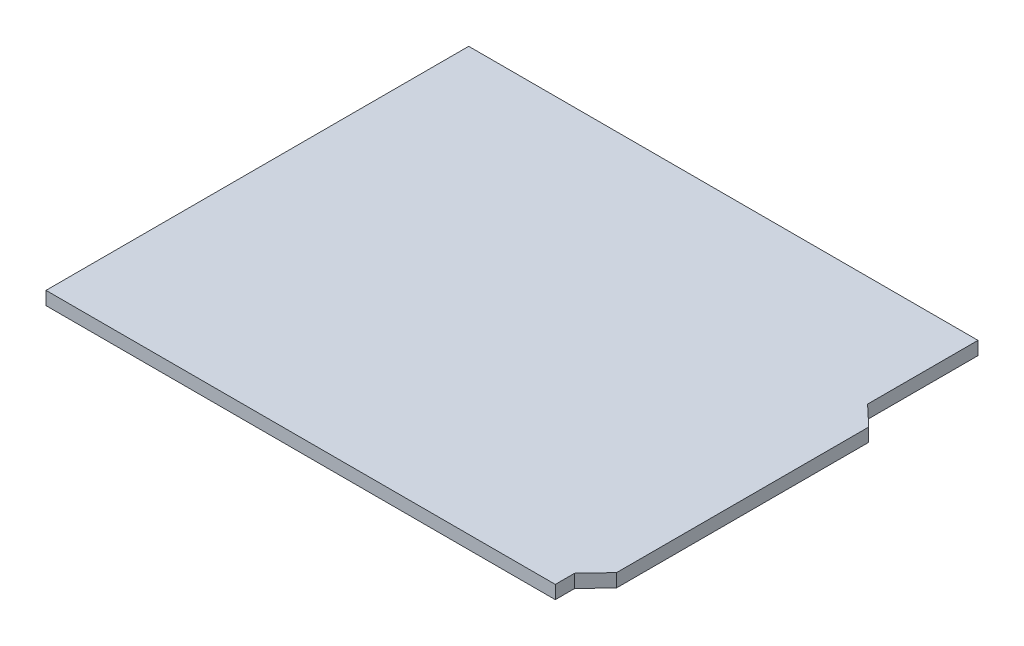
from build123d import *

# Parameters (mm, degrees)
CROQUIS1_W              = 66.05
CROQUIS1_H              = 54.82
SALIENTE_EXTRUIR1_DEPTH = 1.72


with BuildPart() as part:
    # Croquis1 → Saliente-Extruir1 (new body)
    with BuildSketch(Plane(origin=(0, 0, 0), x_dir=(1, 0, 0), z_dir=(0, 1, 0))):
        Rectangle(CROQUIS1_W, CROQUIS1_H)
        Polygon((35.675, 10.59), (33.025, 13.09), (33.025, -24.91), (35.675, -22.11), align=None)
    extrude(amount=SALIENTE_EXTRUIR1_DEPTH)


solid = part.part
